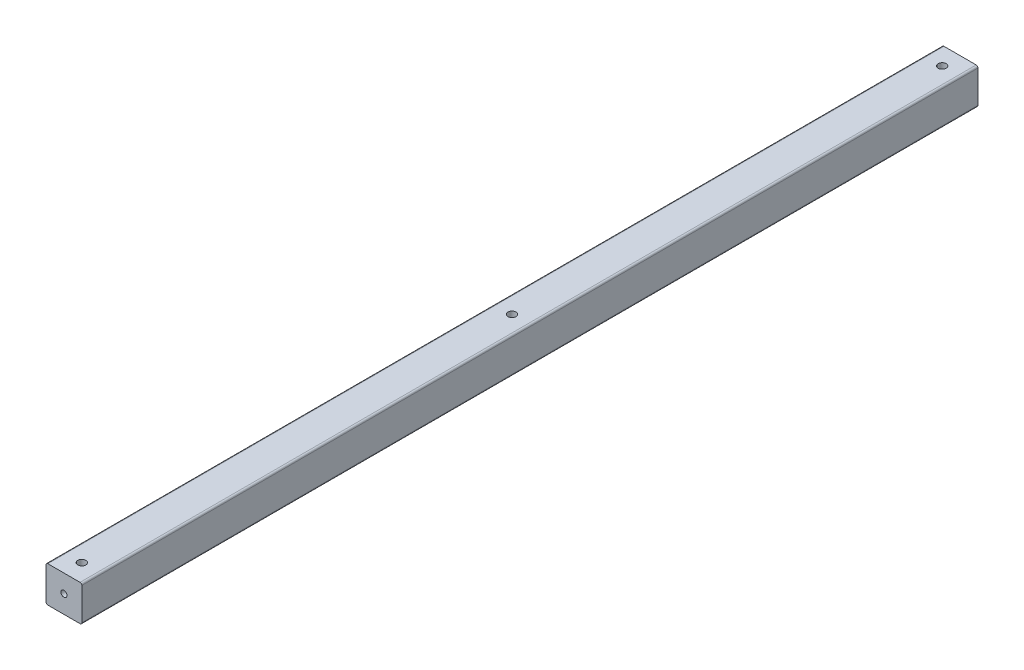
from build123d import *

# Parameters (mm, degrees)
SKETCH1_W                                           = 40
SKETCH1_H                                           = 40
SKETCH1_R                                           = 2.5
BOSS_EXTRUDE1_DEPTH                                 = 500
FILLET1_R                                           = 2
CBORE_FOR_M8_HEX_SOCKET_HEAD_CAP_SCREW1_D           = 9
CBORE_FOR_M8_HEX_SOCKET_HEAD_CAP_SCREW1_CBORE_D     = 15
CBORE_FOR_M8_HEX_SOCKET_HEAD_CAP_SCREW1_CBORE_DEPTH = 8.6


with BuildPart() as part:
    # Sketch1 → Boss-Extrude1 (new, symmetric)
    with BuildSketch(Plane.XY):
        Rectangle(SKETCH1_W, SKETCH1_H)
        Circle(SKETCH1_R, mode=Mode.SUBTRACT)
    extrude(amount=BOSS_EXTRUDE1_DEPTH, both=True)

    # Fillet1
    fillet1_edges = [part.edges().sort_by_distance(p)[0] for p in [
        (20, -20, 0),
        (-20, -20, 0),
        (-20, 20, 0),
        (20, 20, 0),
    ]]
    fillet(fillet1_edges, radius=FILLET1_R)

    # CBORE for M8 Hex Socket Head Cap Screw1 (through all)
    with Locations(Plane(origin=(0, -20, 0), x_dir=(-1, 0, 0), z_dir=(0, -1, 0))):
        with Locations((0, -480), (0, 0), (0, 480)):
            CounterBoreHole(CBORE_FOR_M8_HEX_SOCKET_HEAD_CAP_SCREW1_D / 2, CBORE_FOR_M8_HEX_SOCKET_HEAD_CAP_SCREW1_CBORE_D / 2, CBORE_FOR_M8_HEX_SOCKET_HEAD_CAP_SCREW1_CBORE_DEPTH)

    # Sketch9 → M8x1.25 Tapped Hole1 (revolve, cut)
    with BuildSketch(Plane(origin=(0, 0, 500), x_dir=(0, -1, 0), z_dir=(1, 0, 0))):
        Polygon((0, 0), (0, 29.792926105), (3.4, 27.75), (3.4, 0), align=None)
    m8x1_25_tapped_hole1 = revolve(axis=Axis((0, 0, 506.35), (0, 0, -1)), mode=Mode.SUBTRACT)

    # Mirror1: M8x1.25 Tapped Hole1 across plane
    add(m8x1_25_tapped_hole1.mirror(Plane.XY), mode=Mode.SUBTRACT)


solid = part.part
